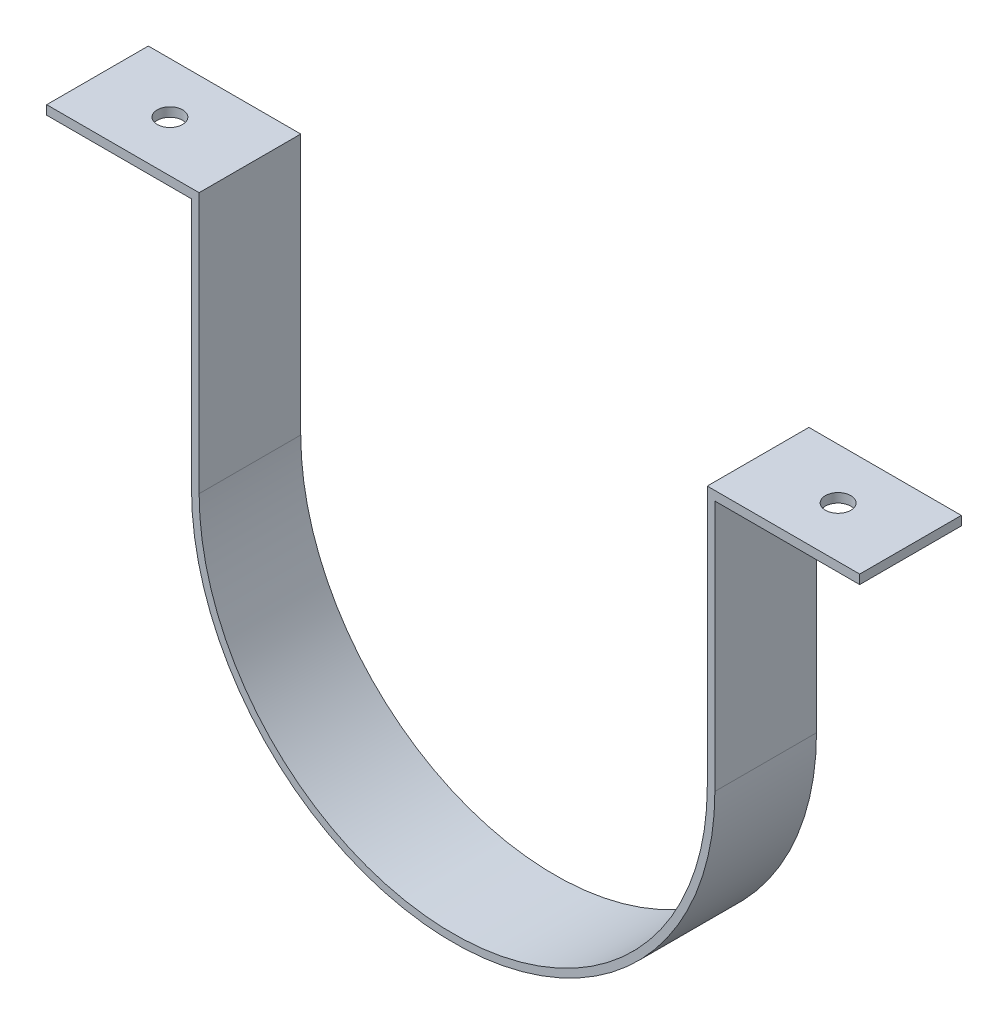
from build123d import *

# Parameters (mm, degrees)
RESSALTO_EXTRUS_O1_DEPTH = 2
ESBO_O2_R                = 0.25
CORTE_EXTRUS_O2_DEPTH    = 2


with BuildPart() as part:
    # Esboço1 → Ressalto-extrusão1 (new body)
    with BuildSketch(Plane.XY):
        with BuildLine():
            Line((104.678372413, -2.590763748), (101.678372413, -2.590763748))
            Line((101.678372413, -2.590763748), (101.678372413, -7.720763748))
            ThreePointArc((101.678372413, -7.720763748), (96.678372413, -12.720763748), (91.678372413, -7.720763748))
            Line((91.678372413, -7.720763748), (91.678372413, -2.590763748))
            Line((91.678372413, -2.590763748), (88.678372413, -2.590763748))
            Line((88.678372413, -2.590763748), (88.678372413, -2.770763748))
            Line((88.678372413, -2.770763748), (91.528372413, -2.770763748))
            Line((91.528372413, -2.770763748), (91.528372413, -7.720763748))
            ThreePointArc((91.528372413, -7.720763748), (96.678372413, -12.870763748), (101.828372413, -7.720763748))
            Line((101.828372413, -7.720763748), (101.828372413, -2.770763748))
            Line((101.828372413, -2.770763748), (104.678372413, -2.770763748))
            Line((104.678372413, -2.770763748), (104.678372413, -2.590763748))
        make_face()
    extrude(amount=RESSALTO_EXTRUS_O1_DEPTH)

    # Esboço2 → Corte-extrusão2 (cut)
    with BuildSketch(Plane.XZ.offset(2.770763748)):
        with Locations(Location((90.103372413, 1, 0), (0, 0, 270))):
            Circle(ESBO_O2_R)
        with Locations(Location((103.253372413, 1, 0), (0, 0, 270))):
            Circle(ESBO_O2_R)
    extrude(amount=-CORTE_EXTRUS_O2_DEPTH, mode=Mode.SUBTRACT)


solid = part.part
